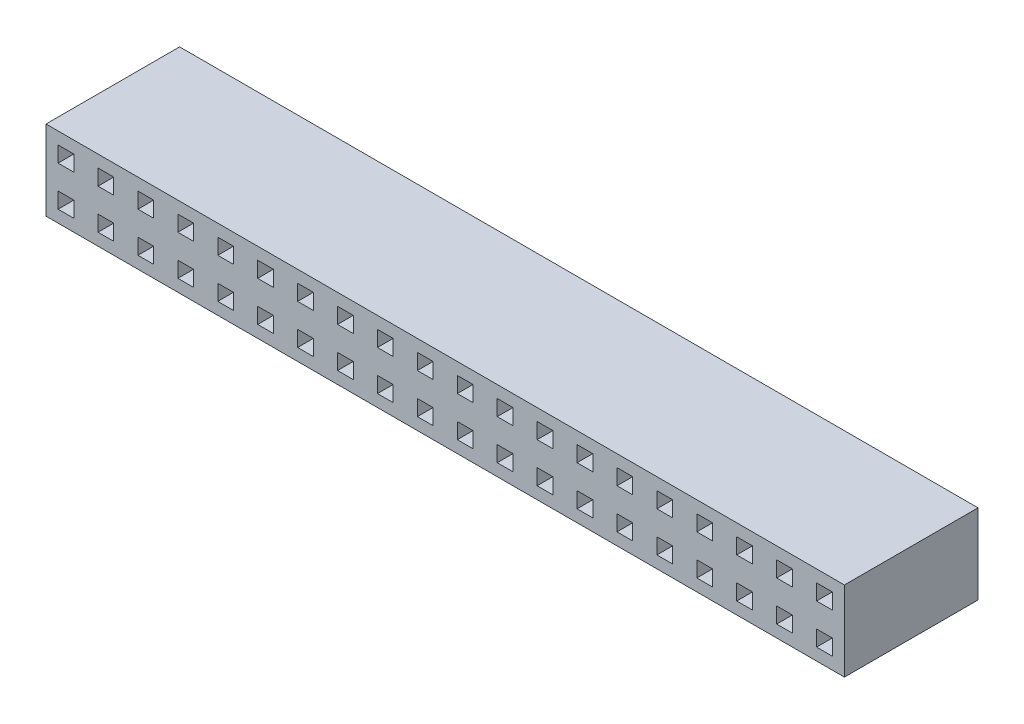
from build123d import *

# Parameters (mm, degrees)
SKETCH1_W               = 50.8
SKETCH1_H               = 5.08
SOCKET_BODY_DEPTH       = 8.5
SOCKET_HOLES_DEPTH      = 81.873800455
SOCKET_HOLES_DEPTH_BACK = 81.873800455
SKETCH2_W               = 1
SKETCH2_H               = 1


with BuildPart() as part:
    # Sketch1 → Socket_Body (new body)
    with BuildSketch(Plane.XY.offset(4.1)):
        with Locations((32.5, 52.5)):
            Rectangle(SKETCH1_W, SKETCH1_H)
    extrude(amount=SOCKET_BODY_DEPTH)

    # Sketch2 → Socket_Holes (cut, two sides: drawn at the far end of the back side and taken through both)
    with BuildSketch(Plane.XY.offset(-SOCKET_HOLES_DEPTH_BACK)):
        with Locations((8.37, 51.23)):
            Rectangle(SKETCH2_W, SKETCH2_H)
        with Locations((8.37, 53.77)):
            Rectangle(SKETCH2_W, SKETCH2_H)
        with Locations((10.91, 51.23)):
            Rectangle(SKETCH2_W, SKETCH2_H)
        with Locations((10.91, 53.77)):
            Rectangle(SKETCH2_W, SKETCH2_H)
        with Locations((13.45, 51.23)):
            Rectangle(SKETCH2_W, SKETCH2_H)
        with Locations((13.45, 53.77)):
            Rectangle(SKETCH2_W, SKETCH2_H)
        with Locations((15.99, 51.23)):
            Rectangle(SKETCH2_W, SKETCH2_H)
        with Locations((15.99, 53.77)):
            Rectangle(SKETCH2_W, SKETCH2_H)
        with Locations((18.53, 51.23)):
            Rectangle(SKETCH2_W, SKETCH2_H)
        with Locations((18.53, 53.77)):
            Rectangle(SKETCH2_W, SKETCH2_H)
        with Locations((21.07, 51.23)):
            Rectangle(SKETCH2_W, SKETCH2_H)
        with Locations((21.07, 53.77)):
            Rectangle(SKETCH2_W, SKETCH2_H)
        with Locations((23.61, 51.23)):
            Rectangle(SKETCH2_W, SKETCH2_H)
        with Locations((23.61, 53.77)):
            Rectangle(SKETCH2_W, SKETCH2_H)
        with Locations((26.15, 51.23)):
            Rectangle(SKETCH2_W, SKETCH2_H)
        with Locations((26.15, 53.77)):
            Rectangle(SKETCH2_W, SKETCH2_H)
        with Locations((28.69, 51.23)):
            Rectangle(SKETCH2_W, SKETCH2_H)
        with Locations((28.69, 53.77)):
            Rectangle(SKETCH2_W, SKETCH2_H)
        with Locations((31.23, 51.23)):
            Rectangle(SKETCH2_W, SKETCH2_H)
        with Locations((31.23, 53.77)):
            Rectangle(SKETCH2_W, SKETCH2_H)
        with Locations((33.77, 51.23)):
            Rectangle(SKETCH2_W, SKETCH2_H)
        with Locations((33.77, 53.77)):
            Rectangle(SKETCH2_W, SKETCH2_H)
        with Locations((36.31, 51.23)):
            Rectangle(SKETCH2_W, SKETCH2_H)
        with Locations((36.31, 53.77)):
            Rectangle(SKETCH2_W, SKETCH2_H)
        with Locations((38.85, 51.23)):
            Rectangle(SKETCH2_W, SKETCH2_H)
        with Locations((38.85, 53.77)):
            Rectangle(SKETCH2_W, SKETCH2_H)
        with Locations((41.39, 51.23)):
            Rectangle(SKETCH2_W, SKETCH2_H)
        with Locations((41.39, 53.77)):
            Rectangle(SKETCH2_W, SKETCH2_H)
        with Locations((43.93, 51.23)):
            Rectangle(SKETCH2_W, SKETCH2_H)
        with Locations((43.93, 53.77)):
            Rectangle(SKETCH2_W, SKETCH2_H)
        with Locations((46.47, 51.23)):
            Rectangle(SKETCH2_W, SKETCH2_H)
        with Locations((46.47, 53.77)):
            Rectangle(SKETCH2_W, SKETCH2_H)
        with Locations((49.01, 51.23)):
            Rectangle(SKETCH2_W, SKETCH2_H)
        with Locations((49.01, 53.77)):
            Rectangle(SKETCH2_W, SKETCH2_H)
        with Locations((51.55, 51.23)):
            Rectangle(SKETCH2_W, SKETCH2_H)
        with Locations((51.55, 53.77)):
            Rectangle(SKETCH2_W, SKETCH2_H)
        with Locations((54.09, 51.23)):
            Rectangle(SKETCH2_W, SKETCH2_H)
        with Locations((54.09, 53.77)):
            Rectangle(SKETCH2_W, SKETCH2_H)
        with Locations((56.63, 51.23)):
            Rectangle(SKETCH2_W, SKETCH2_H)
        with Locations((56.63, 53.77)):
            Rectangle(SKETCH2_W, SKETCH2_H)
    extrude(amount=SOCKET_HOLES_DEPTH + SOCKET_HOLES_DEPTH_BACK, mode=Mode.SUBTRACT)


solid = part.part
